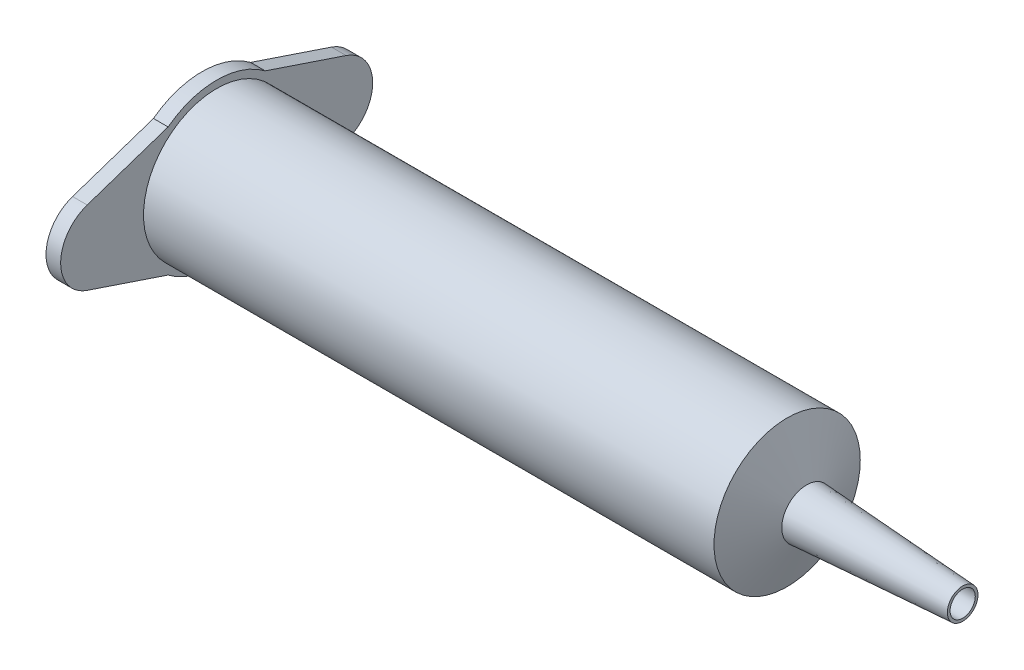
from build123d import *

# Parameters (mm, degrees)
SKETCH1_R           = 15
BOSS_EXTRUDE1_DEPTH = 117
SKETCH2_R           = 15
BOSS_EXTRUDE2_DEPTH = 4
BOSS_EXTRUDE2_TAPER = 68
SKETCH3_R           = 5.099652586
BOSS_EXTRUDE3_DEPTH = 32
BOSS_EXTRUDE3_TAPER = 3.5
BOSS_EXTRUDE4_DEPTH = 3
SKETCH5_R           = 14
CUT_EXTRUDE1_DEPTH  = 117
SKETCH6_R           = 2.583886955
CUT_EXTRUDE2_DEPTH  = 117


with BuildPart() as part:
    # Sketch1 → Boss-Extrude1 (new body)
    with BuildSketch(Plane(origin=(0, 0, 0), x_dir=(0, 0, -1), z_dir=(1, 0, 0))):
        Circle(SKETCH1_R)
    extrude(amount=BOSS_EXTRUDE1_DEPTH)

    # Sketch2 → Boss-Extrude2 (add)
    with BuildSketch(Plane(origin=(117, 0, 0), x_dir=(0, 0, -1), z_dir=(1, 0, 0))):
        Circle(SKETCH2_R)
    extrude(amount=BOSS_EXTRUDE2_DEPTH, taper=BOSS_EXTRUDE2_TAPER)

    # Sketch3 → Boss-Extrude3 (add)
    with BuildSketch(Plane(origin=(121, 0, 0), x_dir=(0, 0, -1), z_dir=(1, 0, 0))):
        Circle(SKETCH3_R)
    extrude(amount=BOSS_EXTRUDE3_DEPTH, taper=BOSS_EXTRUDE3_TAPER)

    # Sketch4 → Boss-Extrude4 (add)
    with BuildSketch(Plane.ZY):
        with BuildLine():
            Line((9.96013089, -13.154739182), (26.54712441, -7.583677026))
            ThreePointArc((26.54712441, -7.583677026), (32, 0), (26.54712441, 7.583677026))
            Line((26.54712441, 7.583677026), (9.96013089, 13.154739182))
            ThreePointArc((9.96013089, 13.154739182), (0, 16.500041524), (-9.96013089, 13.154739182))
            Line((-9.96013089, 13.154739182), (-26.54712441, 7.583677026))
            ThreePointArc((-26.54712441, 7.583677026), (-32, 0), (-26.54712441, -7.583677026))
            Line((-26.54712441, -7.583677026), (-9.96013089, -13.154739182))
            ThreePointArc((-9.96013089, -13.154739182), (0, -16.500041524), (9.96013089, -13.154739182))
        make_face()
    extrude(amount=BOSS_EXTRUDE4_DEPTH)

    # Sketch5 → Cut-Extrude1 (cut)
    with BuildSketch(Plane.ZY.offset(3)):
        Circle(SKETCH5_R)
    extrude(amount=-CUT_EXTRUDE1_DEPTH, mode=Mode.SUBTRACT)

    # Sketch6 → Cut-Extrude2 (cut)
    with BuildSketch(Plane(origin=(153, 0, 0), x_dir=(0, 0, -1), z_dir=(1, 0, 0))):
        Circle(SKETCH6_R)
    extrude(amount=-CUT_EXTRUDE2_DEPTH, mode=Mode.SUBTRACT)


solid = part.part
